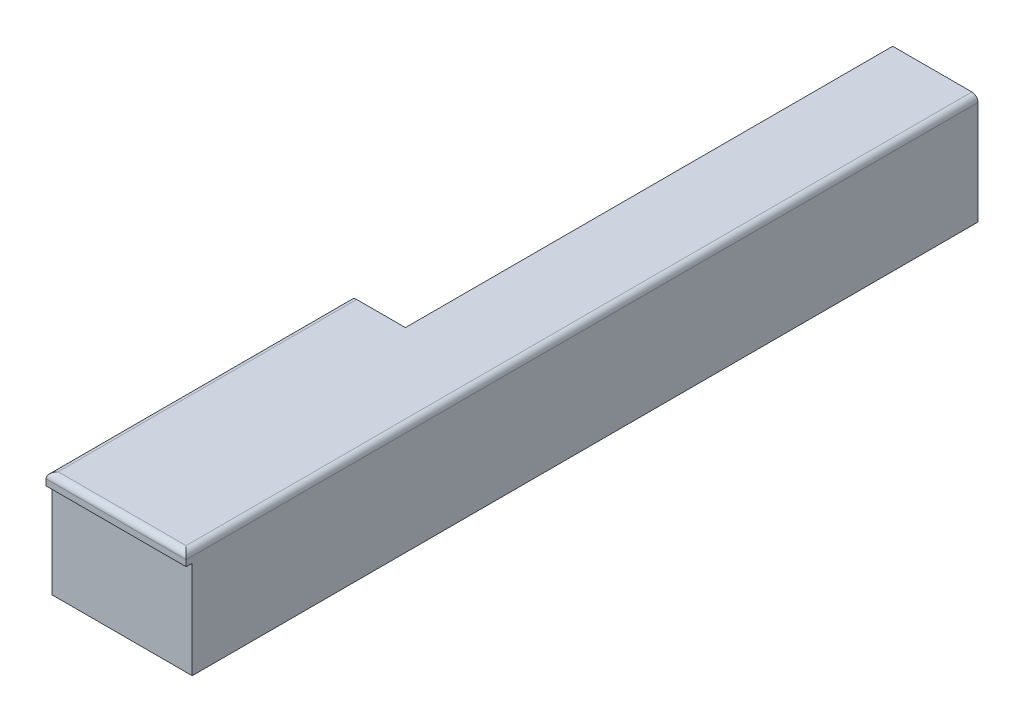
from build123d import *

# Parameters (mm, degrees)
SALIENTE_EXTRUIR1_DEPTH = 18
CROQUIS3_W              = 23
CROQUIS3_H              = 16
CORTAR_EXTRUIR1_DEPTH   = 1
REDONDEO1_R             = 1


with BuildPart() as part:
    # Croquis2 → Saliente-Extruir1 (new body)
    with BuildSketch(Plane(origin=(0, 0, 0), x_dir=(1, 0, 0), z_dir=(0, 1, 0))):
        Polygon((0, 50), (0, 0), (23, 0), (23, 50), (23, 130), (9, 130), (9, 50), align=None)
    extrude(amount=SALIENTE_EXTRUIR1_DEPTH)

    # Croquis3 → Cortar-Extruir1 (cut)
    with BuildSketch(Plane.XY):
        with Locations((11.5, 8)):
            Rectangle(CROQUIS3_W, CROQUIS3_H)
    extrude(amount=-CORTAR_EXTRUIR1_DEPTH, mode=Mode.SUBTRACT)

    # Redondeo1
    redondeo1_edges = [part.edges().sort_by_distance(p)[0] for p in [
        (0, 18, -25),
        (11.5, 18, 0),
        (23, 18, -65),
    ]]
    fillet(redondeo1_edges, radius=REDONDEO1_R)


solid = part.part
